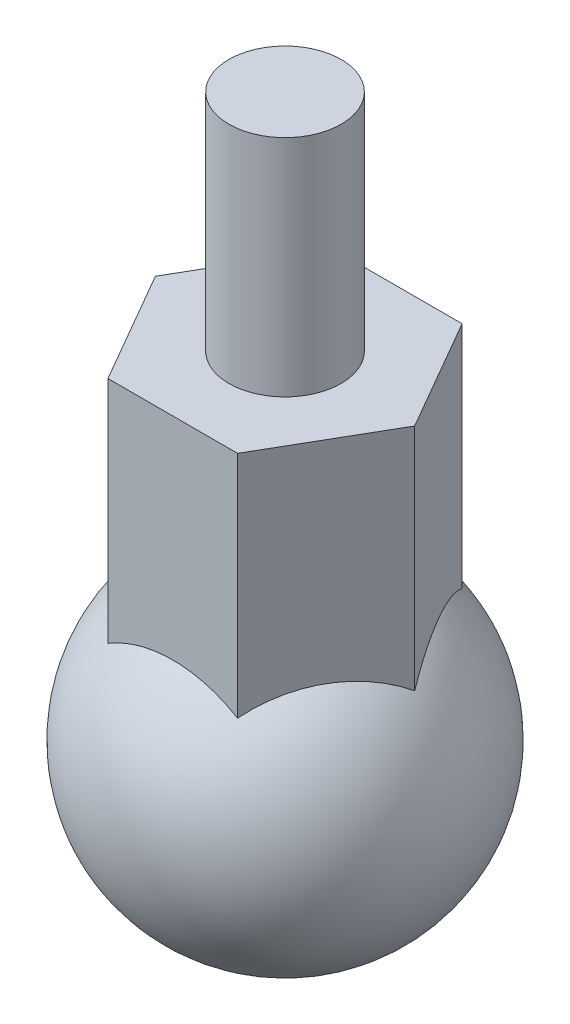
from build123d import *

# Parameters (mm, degrees)
SKETCH_2_R      = 1
EXTRUDE_1_DEPTH = 10
EXTRUDE_2_DEPTH = 6


with BuildPart() as part:
    # 草图1 → 旋转1 (revolve)
    with BuildSketch(Plane(origin=(0, 0, 0), x_dir=(1, 0, 0), z_dir=(0, 1, 0))):
        with BuildLine():
            Line((0, 3), (0, -3))
            ThreePointArc((0, -3), (3, 0), (0, 3))
        make_face()
    revolve(axis=Axis((0, 0, -3), (0, 0, 1)))

    # 草图2 → 凸台-拉伸1 (add)
    with BuildSketch(Plane(origin=(0, 0, 0), x_dir=(1, 0, 0), z_dir=(0, 1, 0))):
        with Locations(Location((0, 0, 0), (0, 0, 90))):
            Circle(SKETCH_2_R)
    extrude(amount=EXTRUDE_1_DEPTH)

    # 草图3 → 凸台-拉伸2 (add)
    with BuildSketch(Plane(origin=(0, 0, 0), x_dir=(1, 0, 0), z_dir=(0, 1, 0))):
        Polygon((2.309401077, 0), (1.154700538, 2), (-1.154700538, 2), (-2.309401077, 0), (-1.154700538, -2), (1.154700538, -2), align=None)
    extrude(amount=EXTRUDE_2_DEPTH)


solid = part.part
